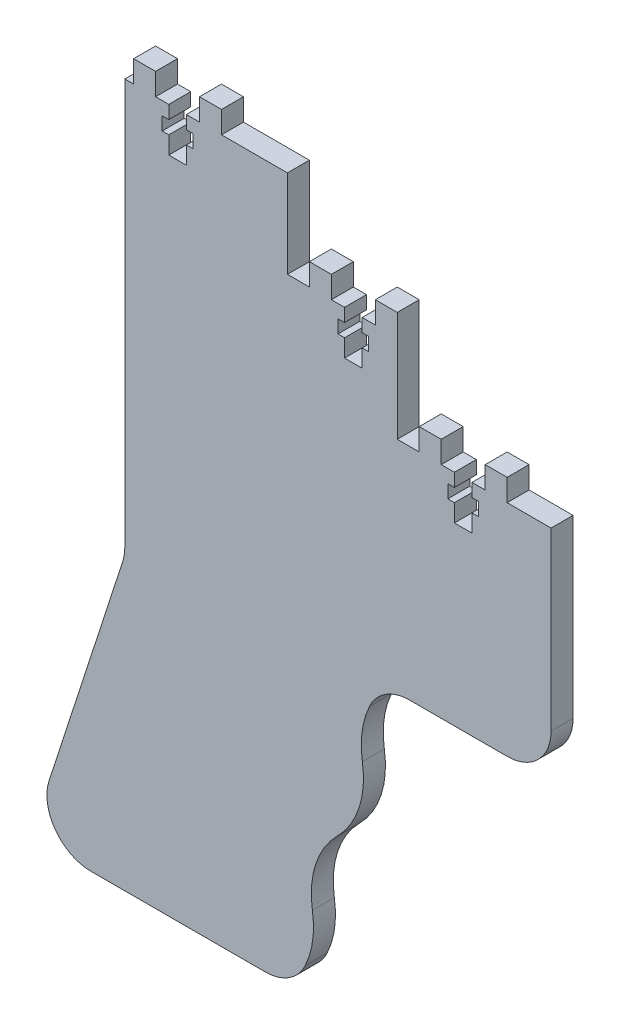
from build123d import *

# Parameters (mm, degrees)
BOSS_EXTRU_1_DEPTH = 5
CONG_1_R           = 10


with BuildPart() as part:
    # Esquisse1 → Boss.-Extru.1 (new body)
    with BuildSketch(Plane.XY):
        with BuildLine():
            Line((10, 0), (10, -20))
            Line((10, -20), (15, -20))
            Line((15, -20), (15, -15))
            Line((15, -15), (20, -15))
            Line((20, -15), (20, -20))
            Line((20, -20), (23, -20))
            Line((23, -20), (23, -23))
            Line((23, -23), (21.5, -23))
            Line((21.5, -23), (21.5, -26))
            Line((21.5, -26), (23, -26))
            Line((23, -26), (23, -30))
            Line((23, -30), (27, -30))
            Line((27, -30), (27, -26))
            Line((27, -26), (28.5, -26))
            Line((28.5, -26), (28.5, -23))
            Line((28.5, -23), (27, -23))
            Line((27, -23), (27, -20))
            Line((27, -20), (30, -20))
            Line((30, -20), (30, -15))
            Line((30, -15), (35, -15))
            Line((35, -15), (35, -20))
            Line((35, -20), (45, -20))
            Line((45, -20), (45, -70))
            Line((45, -70), (7.744378736, -70))
            ThreePointArc((7.744378736, -70), (2.794303084, -78.065385001), (2.058284052, -87.5))
            ThreePointArc((2.058284052, -87.5), (1.322265021, -96.934614999), (-3.627810632, -105))
            ThreePointArc((-3.627810632, -105), (-8.577886284, -113.065385001), (-9.313905316, -122.5))
            ThreePointArc((-9.313905316, -122.5), (-10.049924347, -131.934614999), (-15, -140))
            Line((-15, -140), (-73.488757473, -140))
            Line((-73.488757473, -140), (-52, -73.864404892))
            Line((-52, -73.864404892), (-52, 20))
            Line((-52, 20), (-50, 20))
            Line((-50, 20), (-50, 25))
            Line((-50, 25), (-45, 25))
            Line((-45, 25), (-45, 20))
            Line((-45, 20), (-42, 20))
            Line((-42, 20), (-42, 17))
            Line((-42, 17), (-43.5, 17))
            Line((-43.5, 17), (-43.5, 14))
            Line((-43.5, 14), (-42, 14))
            Line((-42, 14), (-42, 10))
            Line((-42, 10), (-38, 10))
            Line((-38, 10), (-38, 14))
            Line((-38, 14), (-36.5, 14))
            Line((-36.5, 14), (-36.5, 17))
            Line((-36.5, 17), (-38, 17))
            Line((-38, 17), (-38, 20))
            Line((-38, 20), (-35, 20))
            Line((-35, 20), (-35, 25))
            Line((-35, 25), (-30, 25))
            Line((-30, 25), (-30, 20))
            Line((-30, 20), (-15, 20))
            Line((-15, 20), (-15, 0))
            Line((-15, 0), (-10, 0))
            Line((-10, 0), (-10, 5))
            Line((-10, 5), (-5, 5))
            Line((-5, 5), (-5, 0))
            Line((-5, 0), (-2, 0))
            Line((-2, 0), (-2, -3))
            Line((-2, -3), (-3.5, -3))
            Line((-3.5, -3), (-3.5, -6))
            Line((-3.5, -6), (-2, -6))
            Line((-2, -6), (-2, -10))
            Line((-2, -10), (2, -10))
            Line((2, -10), (2, -6))
            Line((2, -6), (3.5, -6))
            Line((3.5, -6), (3.5, -3))
            Line((3.5, -3), (2, -3))
            Line((2, -3), (2, 0))
            Line((2, 0), (5, 0))
            Line((5, 0), (5, 5))
            Line((5, 5), (10, 5))
            Line((10, 5), (10, 0))
        make_face()
    extrude(amount=BOSS_EXTRU_1_DEPTH)

    # Congé1
    cong_1_edges = [part.edges().sort_by_distance(p)[0] for p in [
        (45, -70, 2.5),
        (7.744378736, -70, 2.5),
        (-15, -140, 2.5),
        (-73.488757473, -140, 2.5),
        (-52, -73.864404892, 2.5),
    ]]
    fillet(cong_1_edges, radius=CONG_1_R)


solid = part.part
